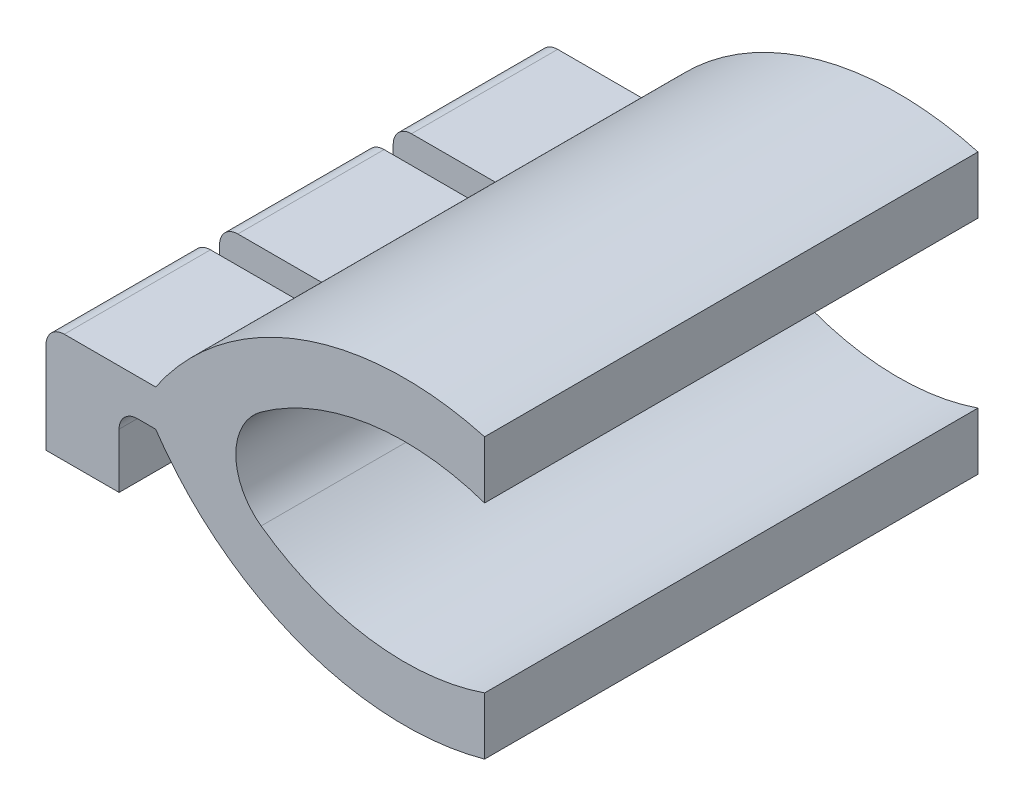
from build123d import *

# Parameters (mm, degrees)
BOSS_EXTRU_1_DEPTH      = 27
ESQUISSE2_W             = 1.5
ESQUISSE2_H             = 20
ENL_V_MAT_EXTRU_3_DEPTH = 6
CONG_1_R                = 1


with BuildPart() as part:
    # Esquisse1 → Boss.-Extru.1 (new body)
    with BuildSketch(Plane.XY):
        with BuildLine():
            Line((-12.734069529, 1), (-18.734069529, 1))
            Line((-18.734069529, 1), (-18.734069529, -5))
            Line((-18.734069529, -5), (-14.734069529, -5))
            Line((-14.734069529, -5), (-14.734069529, -1))
            Line((-14.734069529, -1), (-12.734069529, -1))
            ThreePointArc((-12.734069529, -1), (-4.80129438, -7.212987875), (5.265930471, -7.638574159))
            Line((5.265930471, -7.638574159), (5.265930471, -4.5))
            ThreePointArc((5.265930471, -4.5), (-1.066525943, -5.086207973), (-6.961264916, -2.69964214))
            ThreePointArc((-6.961264916, -2.69964214), (-8.345527914, 0), (-6.961264916, 2.69964214))
            ThreePointArc((-6.961264916, 2.69964214), (-1.066525943, 5.086207973), (5.265930471, 4.5))
            Line((5.265930471, 4.5), (5.265930471, 7.638574159))
            ThreePointArc((5.265930471, 7.638574159), (-4.80129438, 7.212987875), (-12.734069529, 1))
        make_face()
    extrude(amount=BOSS_EXTRU_1_DEPTH)

    # Esquisse2 → Enlèv. mat.-Extru.3 (cut)
    with BuildSketch(Plane.ZY.offset(18.734069529)):
        with Locations((8.75, 1.023656904)):
            Rectangle(ESQUISSE2_W, ESQUISSE2_H)
        with Locations((18.25, 1)):
            Rectangle(ESQUISSE2_W, ESQUISSE2_H)
    extrude(amount=-ENL_V_MAT_EXTRU_3_DEPTH, mode=Mode.SUBTRACT)

    # Congé1
    cong_1_edges = [part.edges().sort_by_distance(p)[0] for p in [
        (-14.734069529, -1, 23),
        (-18.734069529, 1, 23),
        (-14.734069529, -1, 13.5),
        (-14.734069529, -1, 4),
        (-18.734069529, 1, 13.5),
        (-18.734069529, 1, 4),
    ]]
    fillet(cong_1_edges, radius=CONG_1_R)


solid = part.part
